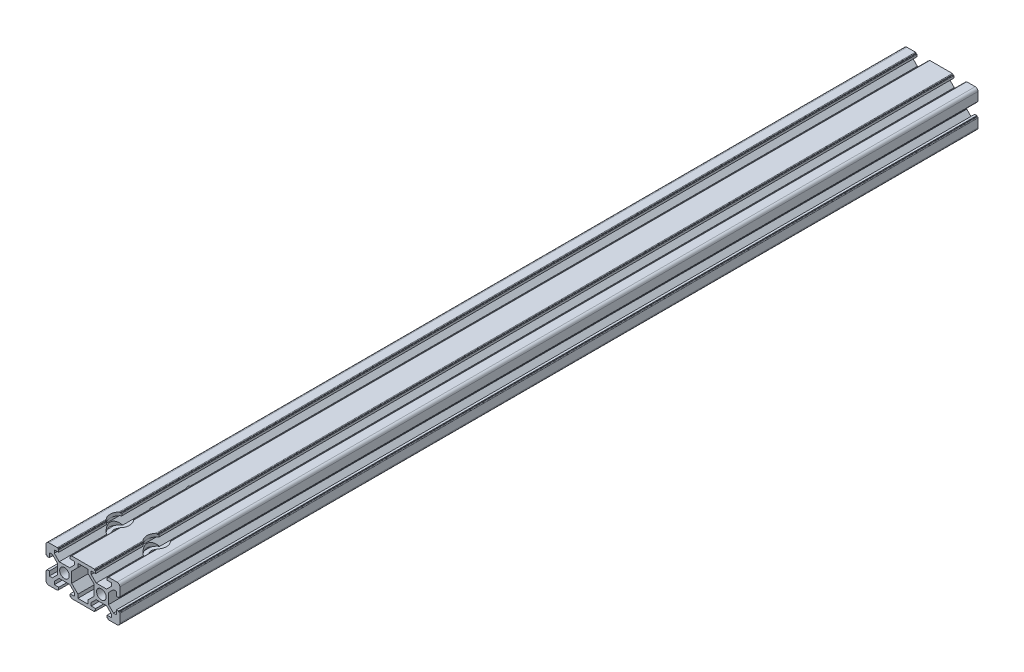
from build123d import *

# Parameters (mm, degrees)
SKETCH_1_R               = 2.6
EXTRUDE_1_DEPTH          = 232.5
FILLET_1_R               = 1.5
FILLET_2_R               = 0.3
CUT_EXTRUDE_1_DEPTH      = 234.772239584
CUT_EXTRUDE_1_DEPTH_BACK = 234.772239584
SKETCH_2_R               = 3.1
SKETCH_3_R               = 5.25
CUT_EXTRUDE_2_DEPTH      = 234.772239683
CUT_EXTRUDE_3_DEPTH      = 234.772239683
CUT_EXTRUDE_3_DEPTH_BACK = 234.772239683
SKETCH_4_R               = 3.1
SKETCH_6_R               = 5.25
CUT_EXTRUDE_4_DEPTH      = 234.772239689


with BuildPart() as part:
    # 草图1 → 凸台-拉伸1 (new, symmetric)
    with BuildSketch(Plane.XY):
        Polygon((-13.9, 0), (-13.9, 2.839339828), (-16.560660172, 5.5), (-18.2, 5.5), (-18.2, 3.1), (-19.4, 3.1), (-19.4, 3.6), (-20, 3.6), (-20, 10), (-13.6, 10), (-13.6, 9.4), (-13.1, 9.4), (-13.1, 8.2), (-15.5, 8.2), (-15.5, 6.560660172), (-12.839339828, 3.9), (-7.160660172, 3.9), (-4.5, 6.560660172), (-4.5, 8.2), (-6.9, 8.2), (-6.9, 9.4), (-6.4, 9.4), (-6.4, 10), (6.4, 10), (6.4, 9.4), (6.9, 9.4), (6.9, 8.2), (4.5, 8.2), (4.5, 6.560660172), (7.160660172, 3.9), (12.839339828, 3.9), (15.5, 6.560660172), (15.5, 8.2), (13.1, 8.2), (13.1, 9.4), (13.6, 9.4), (13.6, 10), (20, 10), (20, 3.6), (19.4, 3.6), (19.4, 3.1), (18.2, 3.1), (18.2, 5.5), (16.560660172, 5.5), (13.9, 2.839339828), (13.9, 0), (13.9, -2.839339828), (16.560660172, -5.5), (18.2, -5.5), (18.2, -3.1), (19.4, -3.1), (19.4, -3.6), (20, -3.6), (20, -10), (13.6, -10), (13.6, -9.4), (13.1, -9.4), (13.1, -8.2), (15.5, -8.2), (15.5, -6.560660172), (12.839339828, -3.9), (7.160660172, -3.9), (4.5, -6.560660172), (4.5, -8.2), (6.9, -8.2), (6.9, -9.4), (6.4, -9.4), (6.4, -10), (-6.4, -10), (-6.4, -9.4), (-6.9, -9.4), (-6.9, -8.2), (-4.5, -8.2), (-4.5, -6.560660172), (-7.160660172, -3.9), (-12.839339828, -3.9), (-15.5, -6.560660172), (-15.5, -8.2), (-13.1, -8.2), (-13.1, -9.4), (-13.6, -9.4), (-13.6, -10), (-20, -10), (-20, -3.6), (-19.4, -3.6), (-19.4, -3.1), (-18.2, -3.1), (-18.2, -5.5), (-16.560660172, -5.5), (-13.9, -2.839339828), align=None)
        with Locations((-10, 0)):
            Circle(SKETCH_1_R, mode=Mode.SUBTRACT)
        with Locations(Location((10, 0, 0), (0, 0, 180))):
            Circle(SKETCH_1_R, mode=Mode.SUBTRACT)
        Polygon((-6.1, -2.839339828), (-6.1, 2.839339828), (-2.7, 6.239339828), (-2.7, 8.2), (2.7, 8.2), (2.7, 6.239339828), (6.1, 2.839339828), (6.1, -2.839339828), (2.7, -6.239339828), (2.7, -8.2), (-2.7, -8.2), (-2.7, -6.239339828), align=None, mode=Mode.SUBTRACT)
    extrude(amount=EXTRUDE_1_DEPTH, both=True)

    # 圆角1
    fillet_1_edges = [part.edges().sort_by_distance(p)[0] for p in [
        (-20, 10, 0),
        (20, 10, 0),
        (20, -10, 0),
        (-20, -10, 0),
    ]]
    fillet(fillet_1_edges, radius=FILLET_1_R)

    # 圆角2
    fillet_2_edges = [part.edges().sort_by_distance(p)[0] for p in [
        (-20, 3.6, 0),
        (-13.6, 10, 0),
        (-6.4, 10, 0),
        (6.4, 10, 0),
        (13.6, 10, 0),
        (20, 3.6, 0),
        (20, -3.6, 0),
        (13.6, -10, 0),
        (6.4, -10, 0),
        (-6.4, -10, 0),
        (-13.6, -10, 0),
        (-20, -3.6, 0),
    ]]
    fillet(fillet_2_edges, radius=FILLET_2_R)

    # 草图2 → 切除-拉伸1 (cut, two sides: drawn at the far end of the back side and taken through both)
    with BuildSketch(Plane.XZ.offset(3.9).offset(-CUT_EXTRUDE_1_DEPTH_BACK)):
        with Locations(Location((-10, 202.5, 0), (0, 0, 336.336158428))):
            Circle(SKETCH_2_R)
        with Locations(Location((10, 202.5, 0), (0, 0, 203.663841572))):
            Circle(SKETCH_2_R)
    extrude(amount=CUT_EXTRUDE_1_DEPTH + CUT_EXTRUDE_1_DEPTH_BACK, mode=Mode.SUBTRACT)

    # 草图3 → 切除-拉伸2 (cut, through all)
    with BuildSketch(Plane(origin=(0, 3.9, 0), x_dir=(1, 0, 0), z_dir=(0, 1, 0))):
        with Locations((-10, -202.5)):
            Circle(SKETCH_3_R)
        with Locations((10, -202.5)):
            Circle(SKETCH_3_R)
    extrude(amount=CUT_EXTRUDE_2_DEPTH, mode=Mode.SUBTRACT)

    # 草图4 → 切除-拉伸3 (cut, two sides: drawn at the far end of the back side and taken through both)
    with BuildSketch(Plane(origin=(0, 3.9, 0), x_dir=(1, 0, 0), z_dir=(0, 1, 0)).offset(-CUT_EXTRUDE_3_DEPTH_BACK)):
        with Locations(Location((-10, -182.5, 0), (0, 0, 336.336158428))):
            Circle(SKETCH_4_R)
        with Locations(Location((-10, -162.5, 0), (0, 0, 336.336158428))):
            Circle(SKETCH_4_R)
    extrude(amount=CUT_EXTRUDE_3_DEPTH + CUT_EXTRUDE_3_DEPTH_BACK, mode=Mode.SUBTRACT)

    # 草图6 → 切除-拉伸4 (cut, through all)
    with BuildSketch(Plane.XZ.offset(3.9)):
        with Locations((-10, 182.5)):
            Circle(SKETCH_6_R)
        with Locations((-10, 162.5)):
            Circle(SKETCH_6_R)
    extrude(amount=CUT_EXTRUDE_4_DEPTH, mode=Mode.SUBTRACT)


solid = part.part
